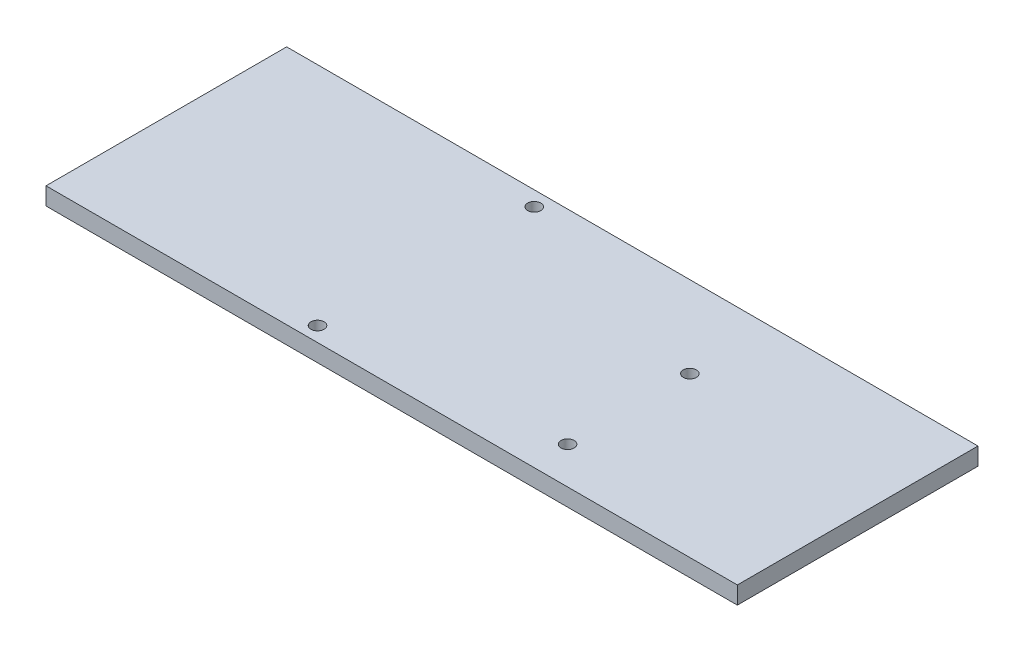
from build123d import *

# Parameters (mm, degrees)
SKETCH1_W           = 158
SKETCH1_H           = 55
BOSS_EXTRUDE1_DEPTH = 4
CUT_EXTRUDE2_REACH  = 169.347
SKETCH2_R           = 1.5


with BuildPart() as part:
    # Sketch1 → Boss-Extrude1 (new body)
    with BuildSketch(Plane(origin=(0, 0, 0), x_dir=(1, 0, 0), z_dir=(0, 1, 0))):
        with Locations((79, 27.5)):
            Rectangle(SKETCH1_W, SKETCH1_H)
    extrude(amount=BOSS_EXTRUDE1_DEPTH)

    # Sketch2 → Cut-Extrude2 (cut, up to next)
    with BuildSketch(Plane(origin=(0, 4, 0), x_dir=(1, 0, 0), z_dir=(0, 1, 0)), mode=Mode.PRIVATE) as cut_extrude2_sk1:
        with Locations(Location((110.75, 36.39, 0), (0, 0, 270))):
            Circle(SKETCH2_R)
    cut_extrude2_tool1 = extrude(cut_extrude2_sk1.sketch, amount=-CUT_EXTRUDE2_REACH, mode=Mode.PRIVATE) & part.part
    # Sketch2 → Cut-Extrude2 (cut, up to next)
    with BuildSketch(Plane(origin=(0, 4, 0), x_dir=(1, 0, 0), z_dir=(0, 1, 0)), mode=Mode.PRIVATE) as cut_extrude2_sk2:
        with Locations(Location((59.95, 51.63, 0), (0, 0, 270))):
            Circle(SKETCH2_R)
    cut_extrude2_tool2 = extrude(cut_extrude2_sk2.sketch, amount=-CUT_EXTRUDE2_REACH, mode=Mode.PRIVATE) & part.part
    # Sketch2 → Cut-Extrude2 (cut, up to next)
    with BuildSketch(Plane(origin=(0, 4, 0), x_dir=(1, 0, 0), z_dir=(0, 1, 0)), mode=Mode.PRIVATE) as cut_extrude2_sk3:
        with Locations(Location((110.75, 8.45, 0), (0, 0, 270))):
            Circle(SKETCH2_R)
    cut_extrude2_tool3 = extrude(cut_extrude2_sk3.sketch, amount=-CUT_EXTRUDE2_REACH, mode=Mode.PRIVATE) & part.part
    # Sketch2 → Cut-Extrude2 (cut, up to next)
    with BuildSketch(Plane(origin=(0, 4, 0), x_dir=(1, 0, 0), z_dir=(0, 1, 0)), mode=Mode.PRIVATE) as cut_extrude2_sk4:
        with Locations(Location((58.68, 3.37, 0), (0, 0, 270))):
            Circle(SKETCH2_R)
    cut_extrude2_tool4 = extrude(cut_extrude2_sk4.sketch, amount=-CUT_EXTRUDE2_REACH, mode=Mode.PRIVATE) & part.part
    add(cut_extrude2_tool1.solids().sort_by_distance((110.75, 4, -36.39))[0], mode=Mode.SUBTRACT)
    add(cut_extrude2_tool2.solids().sort_by_distance((59.95, 4, -51.63))[0], mode=Mode.SUBTRACT)
    add(cut_extrude2_tool3.solids().sort_by_distance((110.75, 4, -8.45))[0], mode=Mode.SUBTRACT)
    add(cut_extrude2_tool4.solids().sort_by_distance((58.68, 4, -3.37))[0], mode=Mode.SUBTRACT)


solid = part.part
